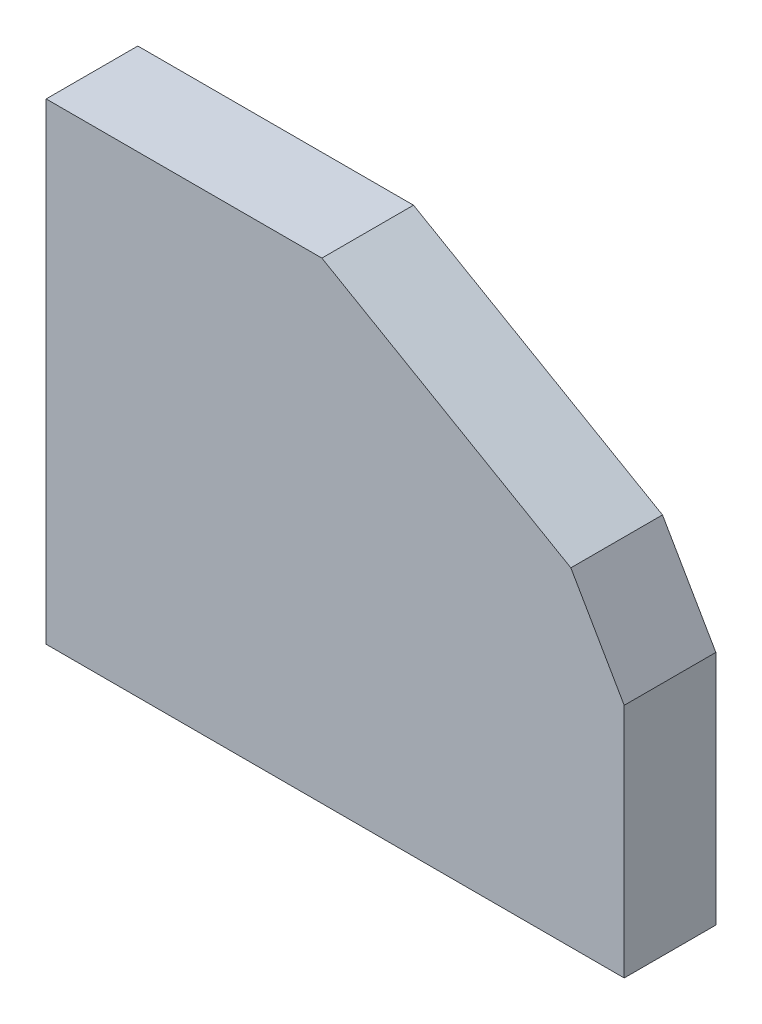
from build123d import *

# Parameters (mm, degrees)
SALIENTE_EXTRUIR1_DEPTH = 13


with BuildPart() as part:
    # Croquis1 → Saliente-Extruir1 (new body)
    with BuildSketch(Plane.XY):
        Polygon((41, -33.5), (-41, -33.5), (-41, 33.5), (-1.887437205, 33.5), (33.431867576, 13.108389878), (41, 0), align=None)
    extrude(amount=SALIENTE_EXTRUIR1_DEPTH)


solid = part.part
